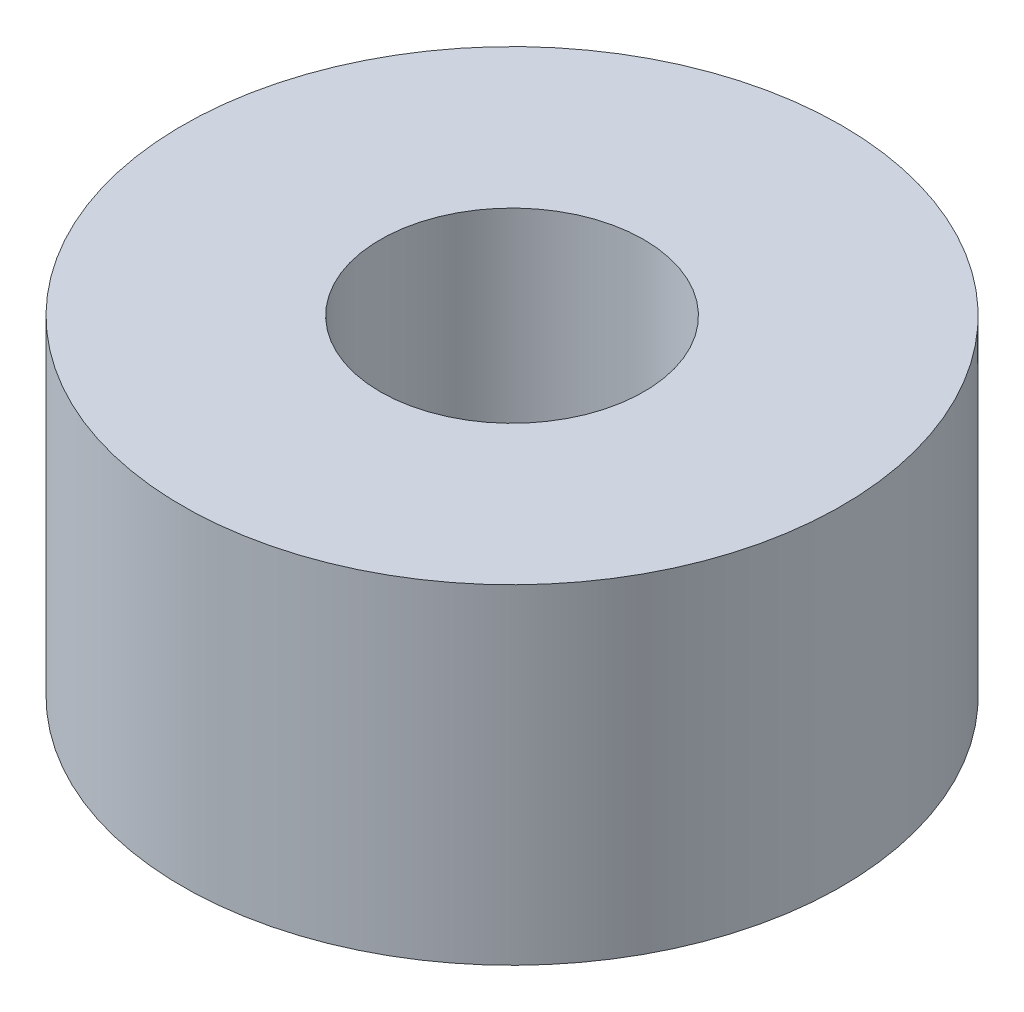
from build123d import *

# Parameters (mm, degrees)
SKETCH_1_W = 1.5
SKETCH_1_H = 2.5


with BuildPart() as part:
    # 草图1 → 旋转1 (revolve)
    with BuildSketch(Plane.XY, mode=Mode.PRIVATE) as revolve_1_sk:
        with Locations((1.75, 1.25)):
            Rectangle(SKETCH_1_W, SKETCH_1_H)
    revolve(revolve_1_sk.sketch.rotate(Axis((0, 2.5, 0), (0, -1, 0)), 270), axis=Axis((0, 2.5, 0), (0, -1, 0)))


solid = part.part
